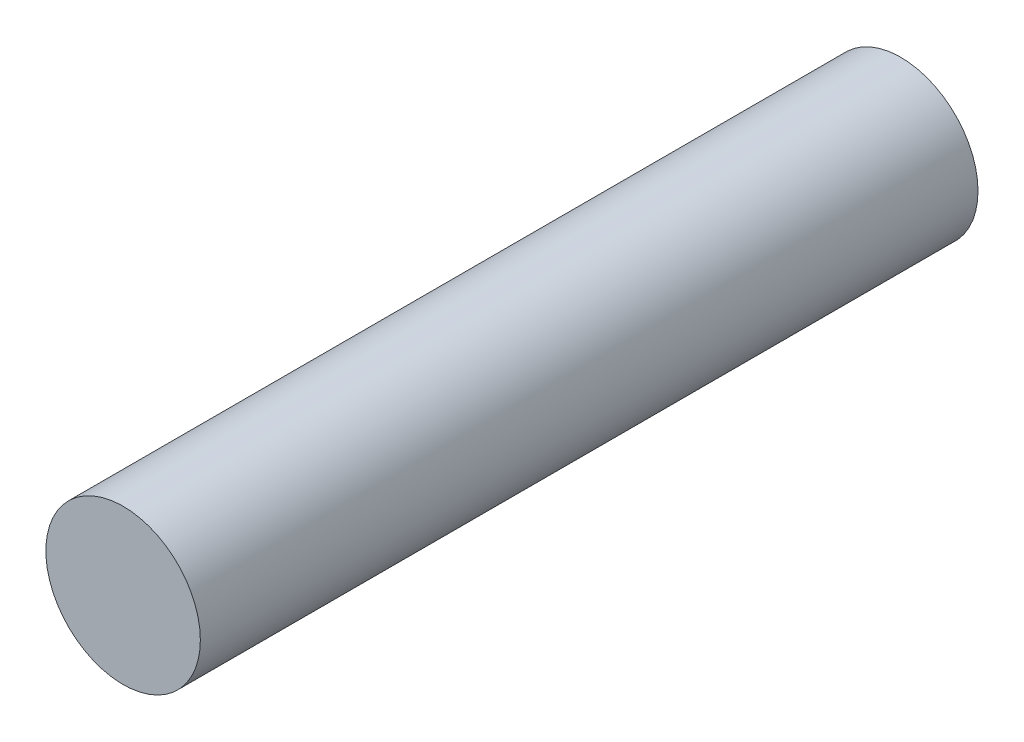
from build123d import *

# Parameters (mm, degrees)
SKETCH_1_R      = 1.49
EXTRUDE_1_DEPTH = 15


with BuildPart() as part:
    # 草图1 → 凸台-拉伸1 (new body)
    with BuildSketch(Plane.XY):
        Circle(SKETCH_1_R)
    extrude(amount=EXTRUDE_1_DEPTH)


solid = part.part
